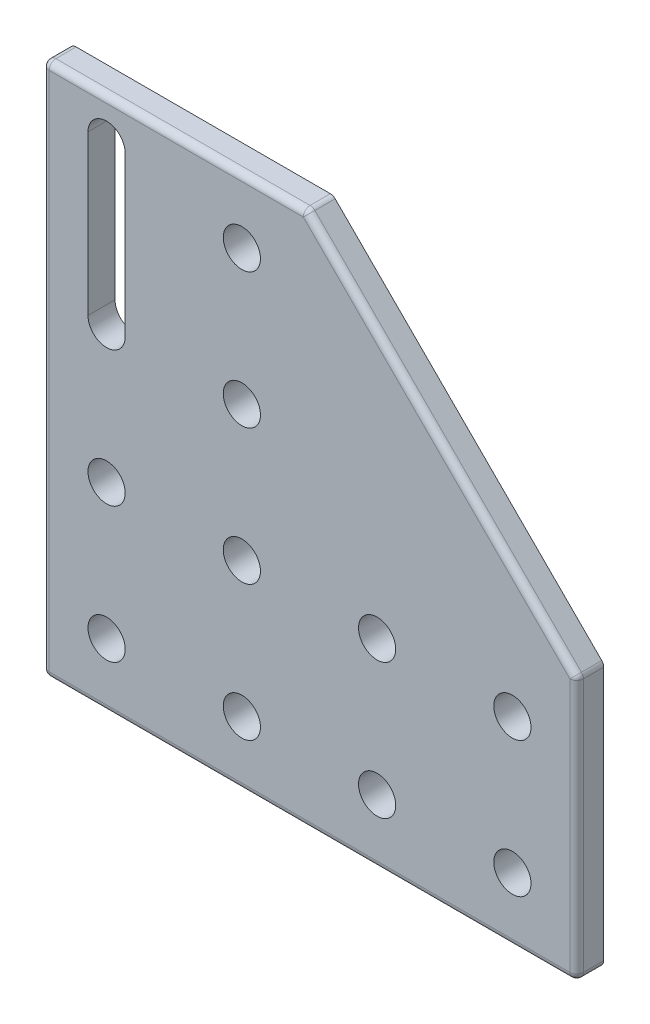
from build123d import *

# Parameters (mm, degrees)
SKETCH1_R           = 2.75
BOSS_EXTRUDE1_DEPTH = 2
FILLET1_R           = 1


with BuildPart() as part:
    # Sketch1 → Boss-Extrude1 (new, symmetric)
    with BuildSketch(Plane.XY):
        Polygon((0, 0), (0, 79), (39, 79), (79, 39), (79, 0), align=None)
        with Locations((9.5, 9.5)):
            Circle(SKETCH1_R, mode=Mode.SUBTRACT)
        with Locations((29.5, 9.5)):
            Circle(SKETCH1_R, mode=Mode.SUBTRACT)
        with Locations((49.5, 9.5)):
            Circle(SKETCH1_R, mode=Mode.SUBTRACT)
        with Locations((9.5, 29.5)):
            Circle(SKETCH1_R, mode=Mode.SUBTRACT)
        with Locations((69.5, 9.5)):
            Circle(SKETCH1_R, mode=Mode.SUBTRACT)
        with Locations((69.5, 29.5)):
            Circle(SKETCH1_R, mode=Mode.SUBTRACT)
        with Locations((49.5, 29.5)):
            Circle(SKETCH1_R, mode=Mode.SUBTRACT)
        with Locations((29.5, 29.5)):
            Circle(SKETCH1_R, mode=Mode.SUBTRACT)
        with Locations((29.5, 49.5)):
            Circle(SKETCH1_R, mode=Mode.SUBTRACT)
        with Locations((29.5, 69.5)):
            Circle(SKETCH1_R, mode=Mode.SUBTRACT)
        with BuildLine():
            Line((6.75, 73), (6.75, 49.5))
            ThreePointArc((6.75, 49.5), (9.5, 46.75), (12.25, 49.5))
            Line((12.25, 49.5), (12.25, 73))
            ThreePointArc((12.25, 73), (9.5, 75.75), (6.75, 73))
        make_face(mode=Mode.SUBTRACT)
    extrude(amount=BOSS_EXTRUDE1_DEPTH, both=True)

    # Fillet1
    fillet1_edges = [part.edges().sort_by_distance(p)[0] for p in [
        (59, 59, 2),
        (19.5, 79, 2),
        (0, 39.5, 2),
        (39.5, 0, 2),
        (79, 19.5, 2),
        (0, 0, 0),
        (0, 79, 0),
        (39, 79, 0),
        (79, 39, 0),
        (79, 0, 0),
    ]]
    fillet(fillet1_edges, radius=FILLET1_R)


solid = part.part
